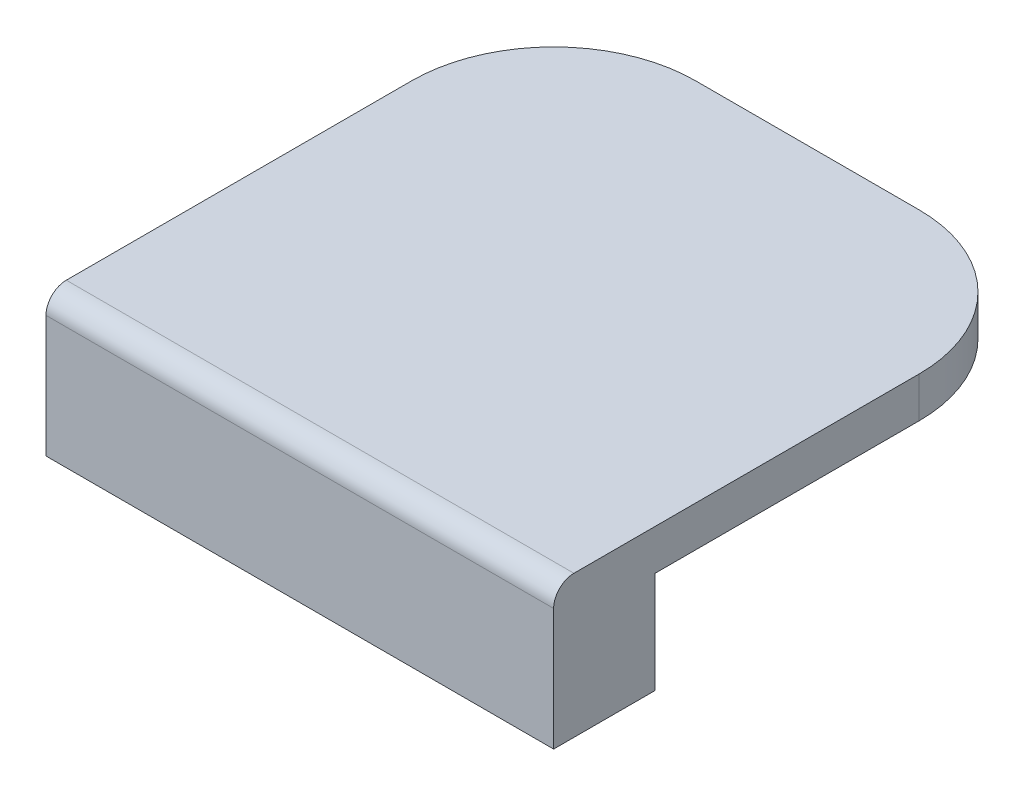
from build123d import *

# Parameters (mm, degrees)
BOSS_EXTRUDE1_DEPTH = 20
SKETCH2_W           = 250
SKETCH2_H           = 50
BOSS_EXTRUDE2_DEPTH = 50
FILLET1_R           = 10


with BuildPart() as part:
    # Sketch1 → Boss-Extrude1 (new body)
    with BuildSketch(Plane(origin=(0, 0, 0), x_dir=(1, 0, 0), z_dir=(0, 1, 0))):
        with BuildLine():
            Line((-55, 125), (55, 125))
            ThreePointArc((55, 125), (104.497474683, 104.497474683), (125, 55))
            Line((125, 55), (125, -125))
            Line((125, -125), (-125, -125))
            Line((-125, -125), (-125, 55))
            ThreePointArc((-125, 55), (-104.497474683, 104.497474683), (-55, 125))
        make_face()
    extrude(amount=BOSS_EXTRUDE1_DEPTH)

    # Sketch2 → Boss-Extrude2 (add)
    with BuildSketch(Plane.XZ):
        with Locations((0, 100)):
            Rectangle(SKETCH2_W, SKETCH2_H)
    extrude(amount=BOSS_EXTRUDE2_DEPTH)

    # Fillet1
    fillet1_edges = [part.edges().sort_by_distance(p)[0] for p in [
        (0, 20, 125),
    ]]
    fillet(fillet1_edges, radius=FILLET1_R)


solid = part.part
